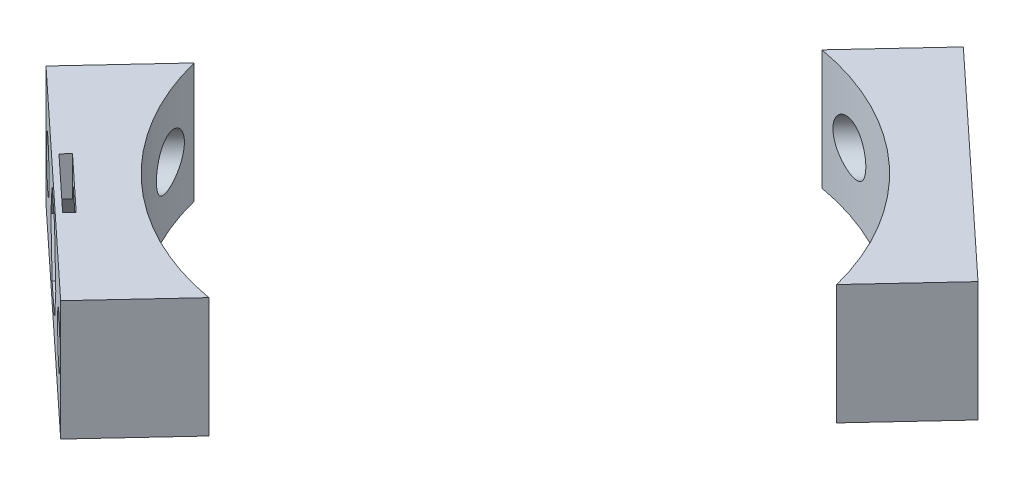
from build123d import *

# Parameters (mm, degrees)
BOSS_EXTRUDE1_DEPTH     = 12.5
BOSS_EXTRUDE1_2_DEPTH   = 12.5
CUT_EXTRUDE1_DEPTH      = 165.810970211
CUT_EXTRUDE1_DEPTH_BACK = 165.810970211
SKETCH3_R               = 5
CUT_EXTRUDE2_DEPTH      = 9
CUT_EXTRUDE3_DEPTH      = 101.311330148
CUT_EXTRUDE3_DEPTH_BACK = 101.311330148
BOSS_EXTRUDE2_START     = 1
SKETCH6_W               = 60
SKETCH6_H               = 25
SKETCH6_R               = 5
BOSS_EXTRUDE2_DEPTH     = 1


with BuildPart() as part:
    # Sketch2 → Boss-Extrude1 (new, symmetric)
    with BuildSketch(Plane(origin=(0, 0, 0), x_dir=(1, 0, 0), z_dir=(0, 1, 0))):
        with BuildLine():
            Line((23.809882535, 69.634255174), (67.737976478, 28.764675258))
            Line((67.737976478, 28.764675258), (53.526372239, 13.48953205))
            ThreePointArc((53.526372239, 13.48953205), (37.600013523, 40.413846427), (9.598278296, 54.359111966))
            Line((9.598278296, 54.359111966), (23.809882535, 69.634255174))
        make_face()
    extrude(amount=BOSS_EXTRUDE1_DEPTH, both=True)


with BuildPart() as body_2:
    # Sketch2 → Boss-Extrude1 2 (new, symmetric)
    with BuildSketch(Plane(origin=(0, 0, 0), x_dir=(1, 0, 0), z_dir=(0, 1, 0))):
        with BuildLine():
            Line((-67.737976478, -28.764675258), (-53.526372239, -13.48953205))
            ThreePointArc((-53.526372239, -13.48953205), (-37.600013523, -40.413846427), (-9.598278296, -54.359111966))
            Line((-9.598278296, -54.359111966), (-23.809882535, -69.634255174))
            Line((-23.809882535, -69.634255174), (-67.737976478, -28.764675258))
        make_face()
    extrude(amount=BOSS_EXTRUDE1_2_DEPTH, both=True)


with BuildPart() as cut_extrude1_tool:
    # Sketch3 → Cut-Extrude1 (new, two sides: drawn at the far end of the back side and taken through both)
    with BuildSketch(Plane(origin=(-45.773929507, 0, 49.199465216), x_dir=(0.7321348990455281, 0, 0.6811596652765007), z_dir=(-0.6811596652765007, 0, 0.7321348990455281)).offset(-CUT_EXTRUDE1_DEPTH_BACK)):
        with Locations((-22.5, 0)):
            Circle(SKETCH3_R)
        Circle(SKETCH3_R)
        with Locations((22.5, 0)):
            Circle(SKETCH3_R)
    extrude(amount=CUT_EXTRUDE1_DEPTH + CUT_EXTRUDE1_DEPTH_BACK)


with BuildPart() as part_1:
    add(part.part)

    # Cut-Extrude1: cut by cut_extrude1_tool
    add(cut_extrude1_tool.part, mode=Mode.SUBTRACT)


with BuildPart() as body_2_1:
    add(body_2.part)

    # Cut-Extrude1: cut by cut_extrude1_tool
    add(cut_extrude1_tool.part, mode=Mode.SUBTRACT)

    # Sketch4 → Cut-Extrude2 (cut)
    with BuildSketch(Plane(origin=(-45.773929507, 0, 49.199465216), x_dir=(0.7321348990455281, 0, 0.6811596652765007), z_dir=(-0.6811596652765007, 0, 0.7321348990455281))):
        Polygon((4.994079828, 8.65), (-4.994079828, 8.65), (-9.988159657, 0), (-4.994079828, -8.65), (4.994079828, -8.65), (9.988159657, 0), align=None)
    extrude(amount=-CUT_EXTRUDE2_DEPTH, mode=Mode.SUBTRACT)

    # Sketch5 → Cut-Extrude3 (cut, two sides: drawn at the far end of the back side and taken through both)
    with BuildSketch(Plane(origin=(0, 12.5, 0), x_dir=(1, 0, 0), z_dir=(0, 1, 0)).offset(-CUT_EXTRUDE3_DEPTH_BACK)):
        Polygon((-51.196825283, -44.017554236), (-40.214801797, -54.234949216), (-38.852482467, -52.770679417), (-49.834505952, -42.553284438), align=None)
    extrude(amount=CUT_EXTRUDE3_DEPTH + CUT_EXTRUDE3_DEPTH_BACK, mode=Mode.SUBTRACT)

    # Sketch6 → Boss-Extrude2 (add)
    with BuildSketch(Plane(origin=(-45.773929507, 0, 49.199465216), x_dir=(0.7321348990455281, 0, 0.6811596652765007), z_dir=(-0.6811596652765007, 0, 0.7321348990455281)).offset(BOSS_EXTRUDE2_START)):
        Rectangle(SKETCH6_W, SKETCH6_H)
        with Locations((-22.5, 0)):
            Circle(SKETCH6_R, mode=Mode.SUBTRACT)
        Polygon((-4.994079828, -8.65), (-9.988159657, 0), (-4.994079828, 8.65), (4.994079828, 8.65), (9.988159657, 0), (4.994079828, -8.65), align=None, mode=Mode.SUBTRACT)
        with Locations((22.5, 0)):
            Circle(SKETCH6_R, mode=Mode.SUBTRACT)
    extrude(amount=-BOSS_EXTRUDE2_DEPTH)


solid = Compound([part_1.part, body_2_1.part])
